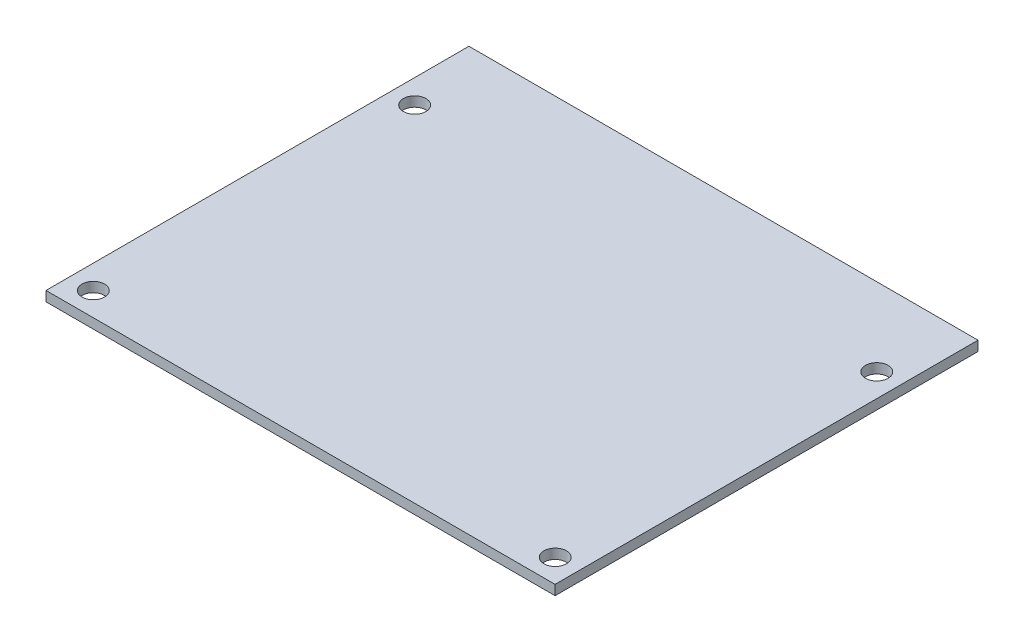
from build123d import *

# Parameters (mm, degrees)
SKETCH1_W           = 82.55
SKETCH1_H           = 68.58
BOSS_EXTRUDE1_DEPTH = 1.6002
SKETCH2_R           = 1.8288
CUT_EXTRUDE1_DEPTH  = 54.684172389
SKETCH3_R           = 1.8288
CUT_EXTRUDE2_DEPTH  = 54.684172389


with BuildPart() as part:
    # Sketch1 → Boss-Extrude1 (new body)
    with BuildSketch(Plane(origin=(0, 0, 0), x_dir=(1, 0, 0), z_dir=(0, 1, 0))):
        Rectangle(SKETCH1_W, SKETCH1_H)
    extrude(amount=BOSS_EXTRUDE1_DEPTH)

    # Sketch2 → Cut-Extrude1 (cut, through all)
    with BuildSketch(Plane(origin=(0, 1.6002, 0), x_dir=(1, 0, 0), z_dir=(0, 1, 0))):
        with Locations(Location((37.488189645, -30.483662755, 0), (0, 0, 270))):
            Circle(SKETCH2_R)
    extrude(amount=-CUT_EXTRUDE1_DEPTH, mode=Mode.SUBTRACT)

    # Sketch3 → Cut-Extrude2 (cut, through all)
    with BuildSketch(Plane(origin=(0, 1.6002, 0), x_dir=(1, 0, 0), z_dir=(0, 1, 0))):
        with Locations(Location((37.513427585, 21.635232225, 0), (0, 0, 270))):
            Circle(SKETCH3_R)
        with Locations(Location((-37.422354938, 21.635232225, 0), (0, 0, 270))):
            Circle(SKETCH3_R)
        with Locations(Location((-37.422354938, -30.469898661, 0), (0, 0, 270))):
            Circle(SKETCH3_R)
    extrude(amount=-CUT_EXTRUDE2_DEPTH, mode=Mode.SUBTRACT)


solid = part.part
